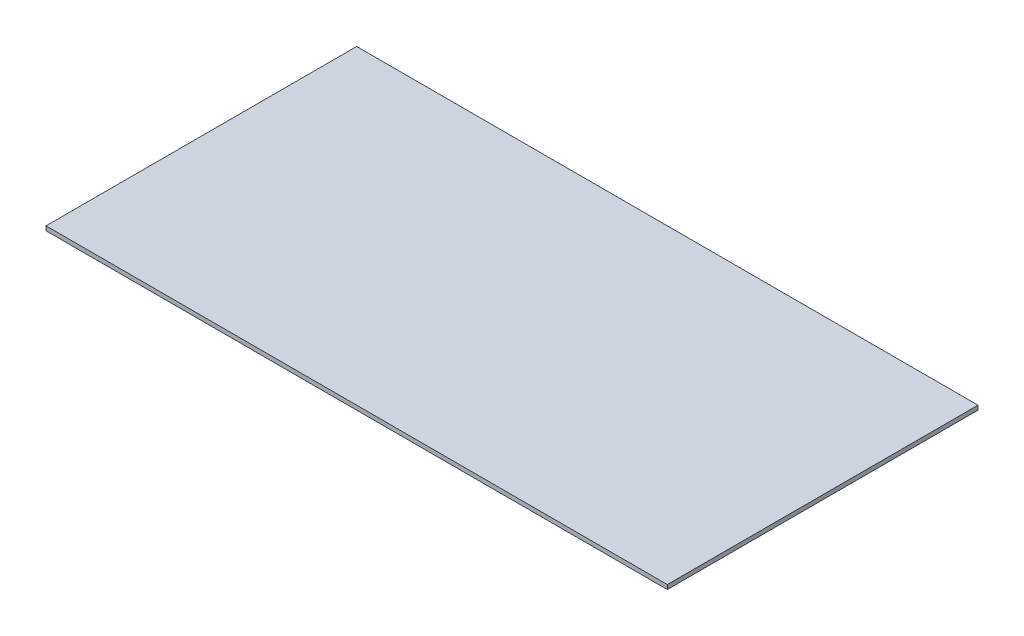
from build123d import *

# Parameters (mm, degrees)
SKETCH1_W           = 1828.8
SKETCH1_H           = 914.4
BOSS_EXTRUDE1_DEPTH = 12.7


with BuildPart() as part:
    # Sketch1 → Boss-Extrude1 (new body)
    with BuildSketch(Plane(origin=(0, 0, 0), x_dir=(1, 0, 0), z_dir=(0, 1, 0))):
        Rectangle(SKETCH1_W, SKETCH1_H)
    extrude(amount=BOSS_EXTRUDE1_DEPTH)


solid = part.part
